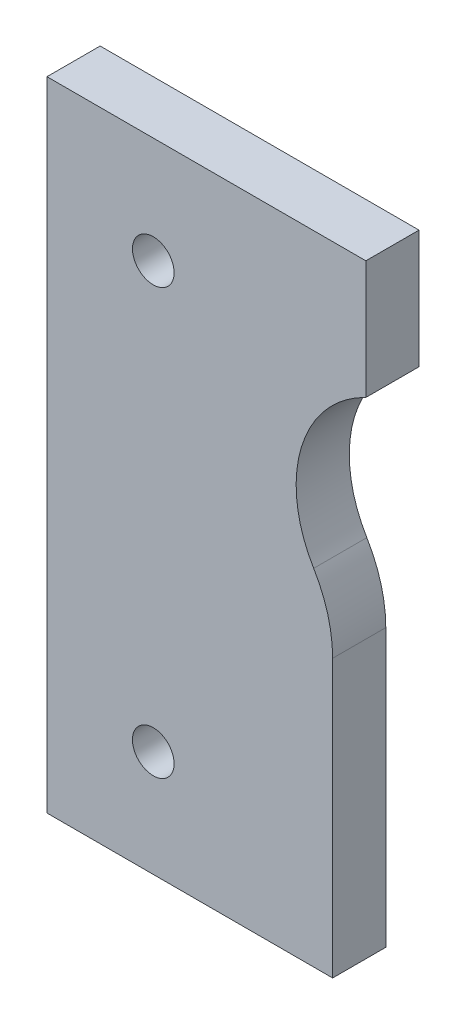
from build123d import *

# Parameters (mm, degrees)
SKETCH1_R           = 2.4892
BOSS_EXTRUDE1_DEPTH = 3.175


with BuildPart() as part:
    # Sketch1 → Boss-Extrude1 (new, symmetric)
    with BuildSketch(Plane.XY):
        with BuildLine():
            Line((-6.35, 27.3812), (-44.45, 27.3812))
            Line((-44.45, 27.3812), (-44.45, -48.8188))
            Line((-44.45, -48.8188), (-10.31875, -48.8188))
            Line((-10.31875, -48.8188), (-10.31875, -15.734319794))
            ThreePointArc((-10.31875, -15.734319794), (-10.89585042, -11.492870345), (-12.585193267, -7.559797873))
            ThreePointArc((-12.585193267, -7.559797873), (-14.062748456, 4.216247062), (-6.35, 13.236885338))
            Line((-6.35, 13.236885338), (-6.35, 27.3812))
        make_face()
        with Locations((-31.75, 14.6812)):
            Circle(SKETCH1_R, mode=Mode.SUBTRACT)
        with Locations((-31.75, -36.1188)):
            Circle(SKETCH1_R, mode=Mode.SUBTRACT)
    extrude(amount=BOSS_EXTRUDE1_DEPTH, both=True)


solid = part.part
